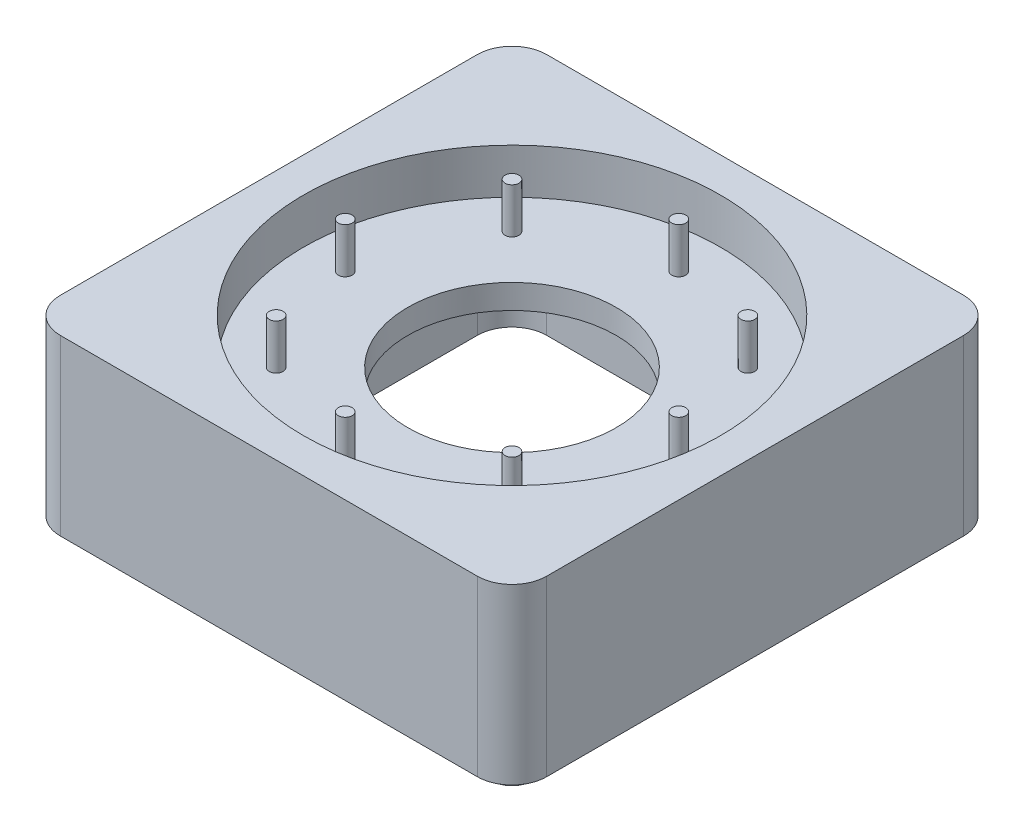
from build123d import *

# Parameters (mm, degrees)
BOSS_EXTRUDE1_DEPTH = 50
SKETCH2_R           = 60
CUT_EXTRUDE1_DEPTH  = 13
SKETCH3_R           = 10
CUT_EXTRUDE2_DEPTH  = 50
SKETCH4_R           = 2
BOSS_EXTRUDE2_DEPTH = 13
CUT_EXTRUDE3_DEPTH  = 30
SKETCH6_R           = 6
BOSS_EXTRUDE4_DEPTH = 3
SKETCH7_R           = 30
CUT_EXTRUDE4_DEPTH  = 40


with BuildPart() as part:
    # Sketch1 → Boss-Extrude1 (new body)
    with BuildSketch(Plane(origin=(0, 0, 0), x_dir=(1, 0, 0), z_dir=(0, 1, 0))):
        with BuildLine():
            Line((-57.148676171, 55.458248473), (62.851323829, 55.458248473))
            ThreePointArc((62.851323829, 55.458248473), (69.922391641, 52.529316284), (72.851323829, 45.458248473))
            Line((72.851323829, 45.458248473), (72.851323829, -74.541751527))
            ThreePointArc((72.851323829, -74.541751527), (69.922391641, -81.612819339), (62.851323829, -84.541751527))
            Line((62.851323829, -84.541751527), (-57.148676171, -84.541751527))
            ThreePointArc((-57.148676171, -84.541751527), (-64.219743983, -81.612819339), (-67.148676171, -74.541751527))
            Line((-67.148676171, -74.541751527), (-67.148676171, 45.458248473))
            ThreePointArc((-67.148676171, 45.458248473), (-64.219743983, 52.529316284), (-57.148676171, 55.458248473))
        make_face()
    extrude(amount=BOSS_EXTRUDE1_DEPTH)

    # Sketch2 → Cut-Extrude1 (cut)
    with BuildSketch(Plane(origin=(0, 50, 0), x_dir=(1, 0, 0), z_dir=(0, 1, 0))):
        with Locations(Location((2.851323829, -14.541751527, 0), (0, 0, 270))):
            Circle(SKETCH2_R)
    extrude(amount=-CUT_EXTRUDE1_DEPTH, mode=Mode.SUBTRACT)

    # Sketch3 → Cut-Extrude2 (cut)
    with BuildSketch(Plane(origin=(0, 37, 0), x_dir=(1, 0, 0), z_dir=(0, 1, 0))):
        with Locations(Location((2.851323829, -14.541751527, 0), (0, 0, 270))):
            Circle(SKETCH3_R)
    extrude(amount=-CUT_EXTRUDE2_DEPTH, mode=Mode.SUBTRACT)

    # Sketch4 → Boss-Extrude2 (add)
    with BuildSketch(Plane(origin=(0, 37, 0), x_dir=(1, 0, 0), z_dir=(0, 1, 0))):
        with Locations(Location((2.851323829, 33.458248473, 0), (0, 0, 90))):
            Circle(SKETCH4_R)
        with Locations(Location((36.792449326, 19.399373969, 0), (0, 0, 90))):
            Circle(SKETCH4_R)
        with Locations(Location((50.851323829, -14.541751527, 0), (0, 0, 90))):
            Circle(SKETCH4_R)
        with Locations(Location((36.792449326, -48.482877024, 0), (0, 0, 90))):
            Circle(SKETCH4_R)
        with Locations(Location((2.851323829, -62.541751527, 0), (0, 0, 90))):
            Circle(SKETCH4_R)
        with Locations(Location((-31.089801668, -48.482877024, 0), (0, 0, 90))):
            Circle(SKETCH4_R)
        with Locations(Location((-45.148676171, -14.541751527, 0), (0, 0, 90))):
            Circle(SKETCH4_R)
        with Locations(Location((-31.089801668, 19.399373969, 0), (0, 0, 90))):
            Circle(SKETCH4_R)
    extrude(amount=BOSS_EXTRUDE2_DEPTH)

    # Sketch5 → Cut-Extrude3 (cut)
    with BuildSketch(Plane.XZ):
        with BuildLine():
            Line((-37.148676171, 64.541751527), (42.851323829, 64.541751527))
            ThreePointArc((42.851323829, 64.541751527), (49.922391641, 61.612819339), (52.851323829, 54.541751527))
            Line((52.851323829, 54.541751527), (52.851323829, -25.458248473))
            ThreePointArc((52.851323829, -25.458248473), (49.922391641, -32.529316284), (42.851323829, -35.458248473))
            Line((42.851323829, -35.458248473), (-37.148676171, -35.458248473))
            ThreePointArc((-37.148676171, -35.458248473), (-44.219743983, -32.529316284), (-47.148676171, -25.458248473))
            Line((-47.148676171, -25.458248473), (-47.148676171, 54.541751527))
            ThreePointArc((-47.148676171, 54.541751527), (-44.219743983, 61.612819339), (-37.148676171, 64.541751527))
        make_face()
    extrude(amount=-CUT_EXTRUDE3_DEPTH, mode=Mode.SUBTRACT)

    # Sketch6 → Boss-Extrude4 (add)
    with BuildSketch(Plane.XZ):
        with Locations(Location((-57.148676171, 74.541751527, 0), (0, 0, 90))):
            Circle(SKETCH6_R)
        with Locations(Location((62.851323829, 74.541751527, 0), (0, 0, 90))):
            Circle(SKETCH6_R)
        with Locations(Location((62.851323829, -45.458248473, 0), (0, 0, 90))):
            Circle(SKETCH6_R)
        with Locations(Location((-57.148676171, -45.458248473, 0), (0, 0, 90))):
            Circle(SKETCH6_R)
    extrude(amount=BOSS_EXTRUDE4_DEPTH)

    # Sketch7 → Cut-Extrude4 (cut)
    with BuildSketch(Plane(origin=(0, 37, 0), x_dir=(1, 0, 0), z_dir=(0, 1, 0))):
        with Locations(Location((2.851323829, -14.541751527, 0), (0, 0, 270))):
            Circle(SKETCH7_R)
    extrude(amount=-CUT_EXTRUDE4_DEPTH, mode=Mode.SUBTRACT)


solid = part.part
